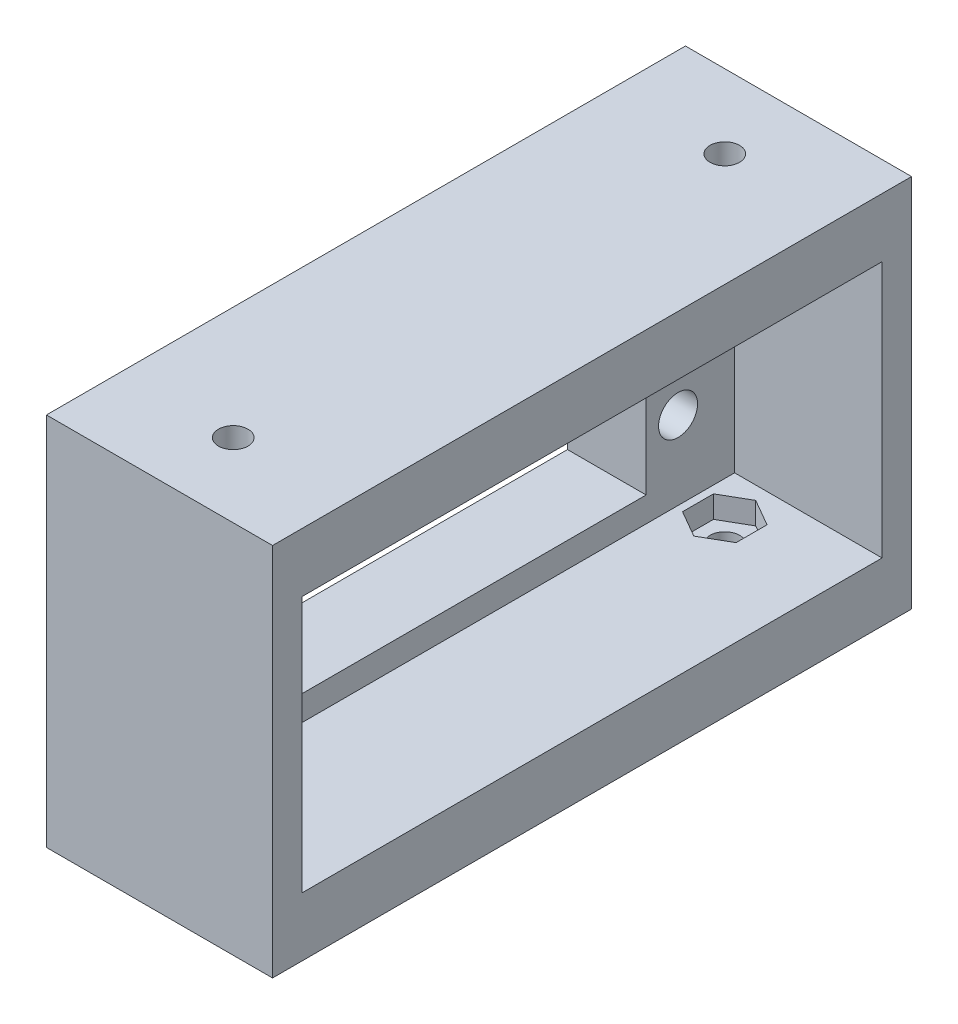
from build123d import *

# Parameters (mm, degrees)
SKETCH1_W                                = 65
SKETCH1_H                                = 38.1
SKETCH1_W_2                              = 41
SKETCH1_H_2                              = 21
BOSS_EXTRUDE1_DEPTH                      = 8
SKETCH2_W                                = 65
SKETCH2_H                                = 38.1
SKETCH2_W_2                              = 59
SKETCH2_H_2                              = 26.1
BOSS_EXTRUDE2_DEPTH                      = 15
F_5_32_0_15625_DIAMETER_HOLE1_D          = 3.96875
F_3_0MM_DOWEL_HOLE1_D                    = 3
F_3_0MM_DOWEL_HOLE1_DEPTH                = 6
CUT_EXTRUDE1_DEPTH                       = 2.25
MIRROR2_AT_THE_SECOND_PLANE_COPY_1_DEPTH = 2.25


with BuildPart() as part:
    # Sketch1 → Boss-Extrude1 (new body)
    with BuildSketch(Plane(origin=(0, 0, 0), x_dir=(0, 0, -1), z_dir=(1, 0, 0))):
        Rectangle(SKETCH1_W, SKETCH1_H)
        Rectangle(SKETCH1_W_2, SKETCH1_H_2, mode=Mode.SUBTRACT)
    extrude(amount=BOSS_EXTRUDE1_DEPTH)

    # Sketch2 → Boss-Extrude2 (add)
    with BuildSketch(Plane(origin=(8, 0, 0), x_dir=(0, 0, -1), z_dir=(1, 0, 0))):
        Rectangle(SKETCH2_W, SKETCH2_H)
        Rectangle(SKETCH2_W_2, SKETCH2_H_2, mode=Mode.SUBTRACT)
    extrude(amount=BOSS_EXTRUDE2_DEPTH)

    # 5/32 (0.15625) Diameter Hole1 (through all)
    with Locations(Plane.ZY):
        with Locations((-23.60854322, 5.122882485), (-23.749, -5.08), (23.749, -5.08), (23.749, 5.08)):
            Hole(F_5_32_0_15625_DIAMETER_HOLE1_D / 2)

    # Ø3.0mm Dowel Hole1
    with Locations(Plane(origin=(0, -13.05, 0), x_dir=(1, 0, 0), z_dir=(0, 1, 0))):
        with Locations((11.5, 25), (11.5, -25)):
            f_3_0mm_dowel_hole1 = Hole(F_3_0MM_DOWEL_HOLE1_D / 2, depth=F_3_0MM_DOWEL_HOLE1_DEPTH)

    # Mirror1: Ø3.0mm Dowel Hole1 across plane
    add(f_3_0mm_dowel_hole1.mirror(Plane.ZX), mode=Mode.SUBTRACT)

    # Sketch7 → Cut-Extrude1 (cut)
    with BuildSketch(Plane(origin=(0, -13.05, 0), x_dir=(1, 0, 0), z_dir=(0, 1, 0))):
        Polygon((8.775, -26.573279484), (11.5, -28.146558967), (14.225, -26.573279484), (14.225, -23.426720516), (11.5, -21.853441033), (8.775, -23.426720516), align=None)
    cut_extrude1 = extrude(amount=-CUT_EXTRUDE1_DEPTH, mode=Mode.SUBTRACT)

    # Mirror2: Cut-Extrude1 across plane
    add(cut_extrude1.mirror(Plane.ZX), mode=Mode.SUBTRACT)

    # Mirror2 at the second plane: Cut-Extrude1 across plane
    add(cut_extrude1.mirror(Plane.XY), mode=Mode.SUBTRACT)

    # Mirror2 at the second plane copy 1 sketc → Mirror2 at the second plane copy 1 (cut)
    with BuildSketch(Plane.XZ.offset(-13.05)):
        Polygon((8.775, -26.573279484), (11.5, -28.146558967), (14.225, -26.573279484), (14.225, -23.426720516), (11.5, -21.853441033), (8.775, -23.426720516), align=None)
    extrude(amount=-MIRROR2_AT_THE_SECOND_PLANE_COPY_1_DEPTH, mode=Mode.SUBTRACT)


solid = part.part
